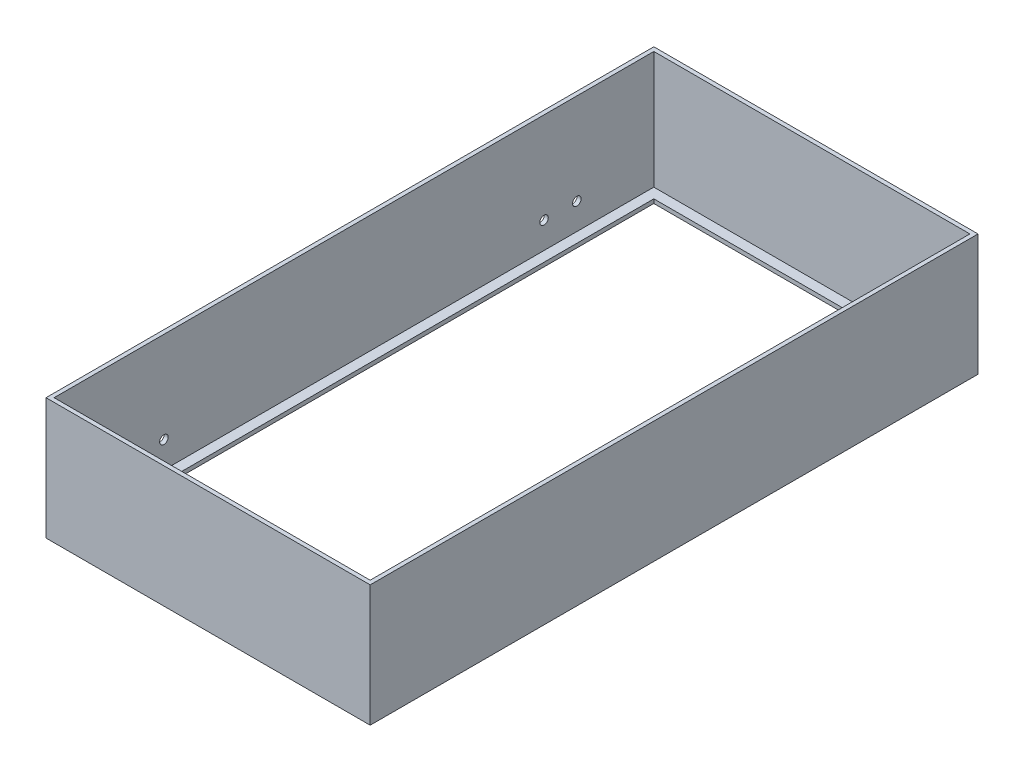
from build123d import *

# Parameters (mm, degrees)
SKETCH2_W           = 203.2
SKETCH2_H           = 76.2
BOSS_EXTRUDE1_DEPTH = 381
SKETCH3_W           = 198.12
SKETCH3_H           = 375.92
CUT_EXTRUDE1_DEPTH  = 439.471983141
SKETCH4_W           = 198.12
SKETCH4_H           = 375.92
SKETCH4_W_2         = 185.42
SKETCH4_H_2         = 363.22
BOSS_EXTRUDE2_DEPTH = 2.54
SKETCH5_R           = 2.667
CUT_EXTRUDE2_DEPTH  = 2.54


with BuildPart() as part:
    # Sketch2 → Boss-Extrude1 (new body)
    with BuildSketch(Plane.XY):
        with Locations((101.6, 38.1)):
            Rectangle(SKETCH2_W, SKETCH2_H)
    extrude(amount=BOSS_EXTRUDE1_DEPTH)

    # Sketch3 → Cut-Extrude1 (cut, through all)
    with BuildSketch(Plane(origin=(0, 76.2, 0), x_dir=(1, 0, 0), z_dir=(0, 1, 0))):
        with Locations((101.6, -190.5)):
            Rectangle(SKETCH3_W, SKETCH3_H)
    extrude(amount=-CUT_EXTRUDE1_DEPTH, mode=Mode.SUBTRACT)

    # Sketch4 → Boss-Extrude2 (add)
    with BuildSketch(Plane(origin=(0, 0, 0), x_dir=(1, 0, 0), z_dir=(0, 1, 0))):
        with Locations((101.6, -190.5)):
            Rectangle(SKETCH4_W, SKETCH4_H)
        with Locations((101.6, -190.5)):
            Rectangle(SKETCH4_W_2, SKETCH4_H_2, mode=Mode.SUBTRACT)
    extrude(amount=BOSS_EXTRUDE2_DEPTH)

    # Sketch5 → Cut-Extrude2 (cut)
    with BuildSketch(Plane.ZY):
        with Locations(Location((309.626, 19.05, 0), (0, 0, 270))):
            Circle(SKETCH5_R)
        with Locations(Location((330.2, 19.05, 0), (0, 0, 270))):
            Circle(SKETCH5_R)
    cut_extrude2 = extrude(amount=-CUT_EXTRUDE2_DEPTH, mode=Mode.SUBTRACT)

    # Mirror1: Cut-Extrude2 across plane
    add(cut_extrude2.mirror(Plane(origin=(0, 0, 190.5), x_dir=(1, 0, 0), z_dir=(0, 0, -1))), mode=Mode.SUBTRACT)


solid = part.part
